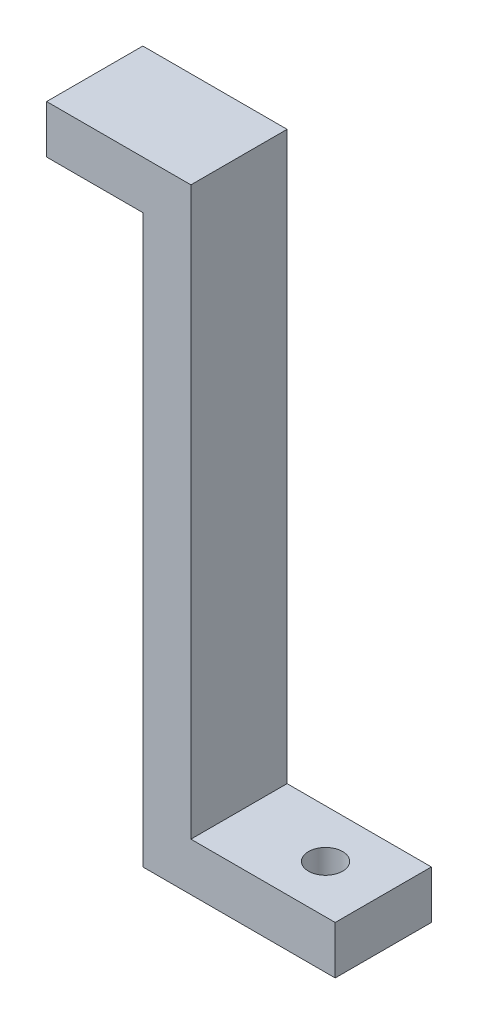
from build123d import *

# Parameters (mm, degrees)
BOSS_EXTRUDE1_DEPTH = 10
SKETCH2_R           = 1.775
CUT_EXTRUDE1_DEPTH  = 67.862723127


with BuildPart() as part:
    # Sketch1 → Boss-Extrude1 (new body)
    with BuildSketch(Plane.XY):
        Polygon((0, 0), (0, 5), (-15, 5), (-15, 63.912), (-30, 63.912), (-30, 58.912), (-20, 58.912), (-20, 0), align=None)
    extrude(amount=BOSS_EXTRUDE1_DEPTH)

    # Sketch2 → Cut-Extrude1 (cut, through all)
    with BuildSketch(Plane(origin=(0, 5, 0), x_dir=(1, 0, 0), z_dir=(0, 1, 0))):
        with Locations(Location((-6, -5, 0), (0, 0, 180))):
            Circle(SKETCH2_R)
    extrude(amount=-CUT_EXTRUDE1_DEPTH, mode=Mode.SUBTRACT)


solid = part.part
